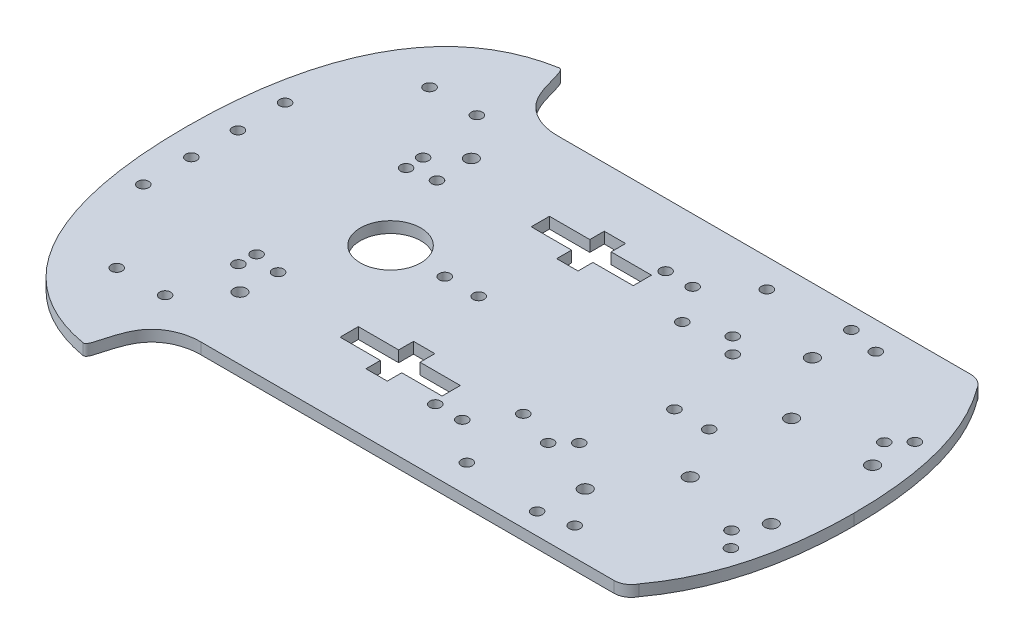
from build123d import *

# Parameters (mm, degrees)
SKETCH3_R           = 1.63195
SKETCH3_R_2         = 1.89865
SKETCH3_R_3         = 8.962636394
BOSS_EXTRUDE1_DEPTH = 3.3


with BuildPart() as part:
    # Sketch3 → Boss-Extrude1 (new body)
    with BuildSketch(Plane(origin=(0, 0, 0), x_dir=(1, 0, 0), z_dir=(0, 1, 0))):
        with BuildLine():
            Line((-19.412747253, 52.829242203), (102.905008148, 52.829242203))
            ThreePointArc((102.905008148, 52.829242203), (105.595648402, 52.072632384), (107.497615337, 50.024578386))
            add(Edge.make_bspline(
                [(107.497615337, 50.024578386), (121.191162078, 31.512548829), (121.191162078, 0)],
                knots=[0, 0, 0, 1, 1, 1], degree=2))
            add(Edge.make_bspline(
                [(107.497615337, -50.024578386), (121.191162078, -31.512548829), (121.191162078, 0)],
                knots=[0, 0, 0, 1, 1, 1], degree=2))
            ThreePointArc((107.497615337, -50.024578386), (105.595648402, -52.072632384), (102.905008148, -52.829242203))
            Line((102.905008148, -52.829242203), (-19.412747253, -52.829242203))
            add(Edge.make_bspline(
                [(-36.650707215, -70.466749861), (-34.711426836, -70.808051725), (-34.724909533, -61.825831762), (-27.646820994, -54.443797364), (-23.250799114, -52.829242203), (-19.412747253, -52.829242203)],
                knots=[0, 0, 0, 0, 0.592102183, 0.692102183, 1, 1, 1, 1], degree=3))
            add(Edge.make_bspline(
                [(-76.701202739, 0), (-76.701202739, -30.929666745), (-68.718634037, -64.822984621), (-36.650707215, -70.466749861)],
                knots=[0, 0, 0, 0, 1, 1, 1, 1], degree=3))
            add(Edge.make_bspline(
                [(-76.701202739, 0), (-76.701202739, 30.929666745), (-68.718634037, 64.822984621), (-36.650707215, 70.466749861)],
                knots=[0, 0, 0, 0, 1, 1, 1, 1], degree=3))
            add(Edge.make_bspline(
                [(-36.650707215, 70.466749861), (-34.711426836, 70.808051725), (-34.724909533, 61.825831762), (-27.646820994, 54.443797364), (-23.250799114, 52.829242203), (-19.412747253, 52.829242203)],
                knots=[0, 0, 0, 0, 0.592102183, 0.692102183, 1, 1, 1, 1], degree=3))
        make_face()
        with Locations(Location((83.035807722, 44.56167379, 0), (0, 0, 270))):
            Circle(SKETCH3_R, mode=Mode.SUBTRACT)
        with Locations(Location((83.035807722, -44.56167379, 0), (0, 0, 90))):
            Circle(SKETCH3_R, mode=Mode.SUBTRACT)
        with Locations(Location((111.943040645, 27.227466133, 0), (0, 0, 270))):
            Circle(SKETCH3_R, mode=Mode.SUBTRACT)
        with Locations(Location((111.943040645, -27.227466133, 0), (0, 0, 90))):
            Circle(SKETCH3_R, mode=Mode.SUBTRACT)
        with Locations(Location((107.497615337, 22.610268935, 0), (0, 0, 270))):
            Circle(SKETCH3_R, mode=Mode.SUBTRACT)
        with Locations(Location((107.497615337, -22.610268935, 0), (0, 0, 90))):
            Circle(SKETCH3_R, mode=Mode.SUBTRACT)
        with Locations(Location((111.666224747, 15, 0), (0, 0, 270))):
            Circle(SKETCH3_R_2, mode=Mode.SUBTRACT)
        with Locations(Location((111.666224747, -15, 0), (0, 0, 90))):
            Circle(SKETCH3_R_2, mode=Mode.SUBTRACT)
        with Locations(Location((87.666224747, 15, 0), (0, 0, 270))):
            Circle(SKETCH3_R_2, mode=Mode.SUBTRACT)
        with Locations(Location((87.666224747, -15, 0), (0, 0, 90))):
            Circle(SKETCH3_R_2, mode=Mode.SUBTRACT)
        with Locations(Location((75.205099745, 33.627264799, 0), (0, 0, 270))):
            Circle(SKETCH3_R_2, mode=Mode.SUBTRACT)
        with Locations(Location((75.205099745, -33.627264799, 0), (0, 0, 90))):
            Circle(SKETCH3_R_2, mode=Mode.SUBTRACT)
        with Locations(Location((73.846750426, 46.522974557, 0), (0, 0, 270))):
            Circle(SKETCH3_R, mode=Mode.SUBTRACT)
        with Locations(Location((73.846750426, -46.522974557, 0), (0, 0, 90))):
            Circle(SKETCH3_R, mode=Mode.SUBTRACT)
        with Locations(Location((62.53353943, 22.717090363, 0), (0, 0, 270))):
            Circle(SKETCH3_R, mode=Mode.SUBTRACT)
        with Locations(Location((62.53353943, -22.717090363, 0), (0, 0, 90))):
            Circle(SKETCH3_R, mode=Mode.SUBTRACT)
        with Locations(Location((57.916606771, 27.334023022, 0), (0, 0, 270))):
            Circle(SKETCH3_R, mode=Mode.SUBTRACT)
        with Locations(Location((57.916606771, -27.334023022, 0), (0, 0, 90))):
            Circle(SKETCH3_R, mode=Mode.SUBTRACT)
        with Locations(Location((50.945704163, 44.414408656, 0), (0, 0, 270))):
            Circle(SKETCH3_R, mode=Mode.SUBTRACT)
        with Locations(Location((50.945704163, -44.414408656, 0), (0, 0, 90))):
            Circle(SKETCH3_R, mode=Mode.SUBTRACT)
        with Locations(Location((46.781864412, 23.53455238, 0), (0, 0, 270))):
            Circle(SKETCH3_R, mode=Mode.SUBTRACT)
        with Locations(Location((46.781864412, -23.53455238, 0), (0, 0, 90))):
            Circle(SKETCH3_R, mode=Mode.SUBTRACT)
        with Locations(Location((39.284916667, 34.098304181, 0), (0, 0, 270))):
            Circle(SKETCH3_R, mode=Mode.SUBTRACT)
        with Locations(Location((39.284916667, -34.098304181, 0), (0, 0, 90))):
            Circle(SKETCH3_R, mode=Mode.SUBTRACT)
        with Locations(Location((31.284916667, 34.098304181, 0), (0, 0, 270))):
            Circle(SKETCH3_R, mode=Mode.SUBTRACT)
        with Locations(Location((31.284916667, -34.098304181, 0), (0, 0, 90))):
            Circle(SKETCH3_R, mode=Mode.SUBTRACT)
        with Locations(Location((-26.375402413, 34.25317527, 0), (0, 0, 270))):
            Circle(SKETCH3_R_2, mode=Mode.SUBTRACT)
        with Locations(Location((-26.375402413, -34.25317527, 0), (0, 0, 90))):
            Circle(SKETCH3_R_2, mode=Mode.SUBTRACT)
        with Locations(Location((-25.829159842, 23.525142795, 0), (0, 0, 270))):
            Circle(SKETCH3_R, mode=Mode.SUBTRACT)
        with Locations(Location((-25.829159842, -23.525142795, 0), (0, 0, 90))):
            Circle(SKETCH3_R, mode=Mode.SUBTRACT)
        with Locations(Location((-33.59104133, 22.129151777, 0), (0, 0, 270))):
            Circle(SKETCH3_R, mode=Mode.SUBTRACT)
        with Locations(Location((-33.59104133, -22.129151777, 0), (0, 0, 90))):
            Circle(SKETCH3_R, mode=Mode.SUBTRACT)
        with Locations(Location((-36.650707215, 46.142478568, 0), (0, 0, 270))):
            Circle(SKETCH3_R, mode=Mode.SUBTRACT)
        with Locations(Location((-36.650707215, -46.142478568, 0), (0, 0, 90))):
            Circle(SKETCH3_R, mode=Mode.SUBTRACT)
        with Locations(Location((-50.818365766, 46.30222602, 0), (0, 0, 270))):
            Circle(SKETCH3_R, mode=Mode.SUBTRACT)
        with Locations(Location((-50.818365766, -46.30222602, 0), (0, 0, 90))):
            Circle(SKETCH3_R, mode=Mode.SUBTRACT)
        with Locations(Location((-68.273903527, 20.985394647, 0), (0, 0, 270))):
            Circle(SKETCH3_R, mode=Mode.SUBTRACT)
        with Locations(Location((-68.273903527, -20.985394647, 0), (0, 0, 90))):
            Circle(SKETCH3_R, mode=Mode.SUBTRACT)
        with Locations(Location((-68.129041774, 6.896821773, 0), (0, 0, 270))):
            Circle(SKETCH3_R, mode=Mode.SUBTRACT)
        with Locations(Location((-68.129041774, -6.896821773, 0), (0, 0, 90))):
            Circle(SKETCH3_R, mode=Mode.SUBTRACT)
        with Locations(Location((-16.053014444, 0, 0), (0, 0, 270))):
            Circle(SKETCH3_R_3, mode=Mode.SUBTRACT)
        with Locations(Location((10.044832328, 0, 0), (0, 0, 270))):
            Circle(SKETCH3_R, mode=Mode.SUBTRACT)
        with Locations(Location((68.000684971, 0, 0), (0, 0, 270))):
            Circle(SKETCH3_R, mode=Mode.SUBTRACT)
        with Locations(Location((78.271931801, 0, 0), (0, 0, 270))):
            Circle(SKETCH3_R, mode=Mode.SUBTRACT)
        with Locations(Location((-33.750207153, 27.334023022, 0), (0, 0, 270))):
            Circle(SKETCH3_R, mode=Mode.SUBTRACT)
        with Locations(Location((-33.750207153, -27.334023022, 0), (0, 0, 90))):
            Circle(SKETCH3_R, mode=Mode.SUBTRACT)
        with Locations(Location((0, 0, 0), (0, 0, 270))):
            Circle(SKETCH3_R, mode=Mode.SUBTRACT)
        Polygon((11.94, 30.992945559), (0, 30.992945559), (0, 25.592945559), (11.94, 25.592945559), (11.94, 21.192394067), (18.26, 21.192394067), (18.26, 25.592945559), (30.2, 25.592945559), (30.2, 30.992945559), (18.26, 30.992945559), (18.26, 35.273941836), (11.94, 35.273941836), align=None, mode=Mode.SUBTRACT)
        Polygon((11.94, -30.992945559), (0, -30.992945559), (0, -25.592945559), (11.94, -25.592945559), (11.94, -21.192394067), (18.26, -21.192394067), (18.26, -25.592945559), (30.2, -25.592945559), (30.2, -30.992945559), (18.26, -30.992945559), (18.26, -35.273941836), (11.94, -35.273941836), align=None, mode=Mode.SUBTRACT)
    extrude(amount=BOSS_EXTRUDE1_DEPTH)


solid = part.part
